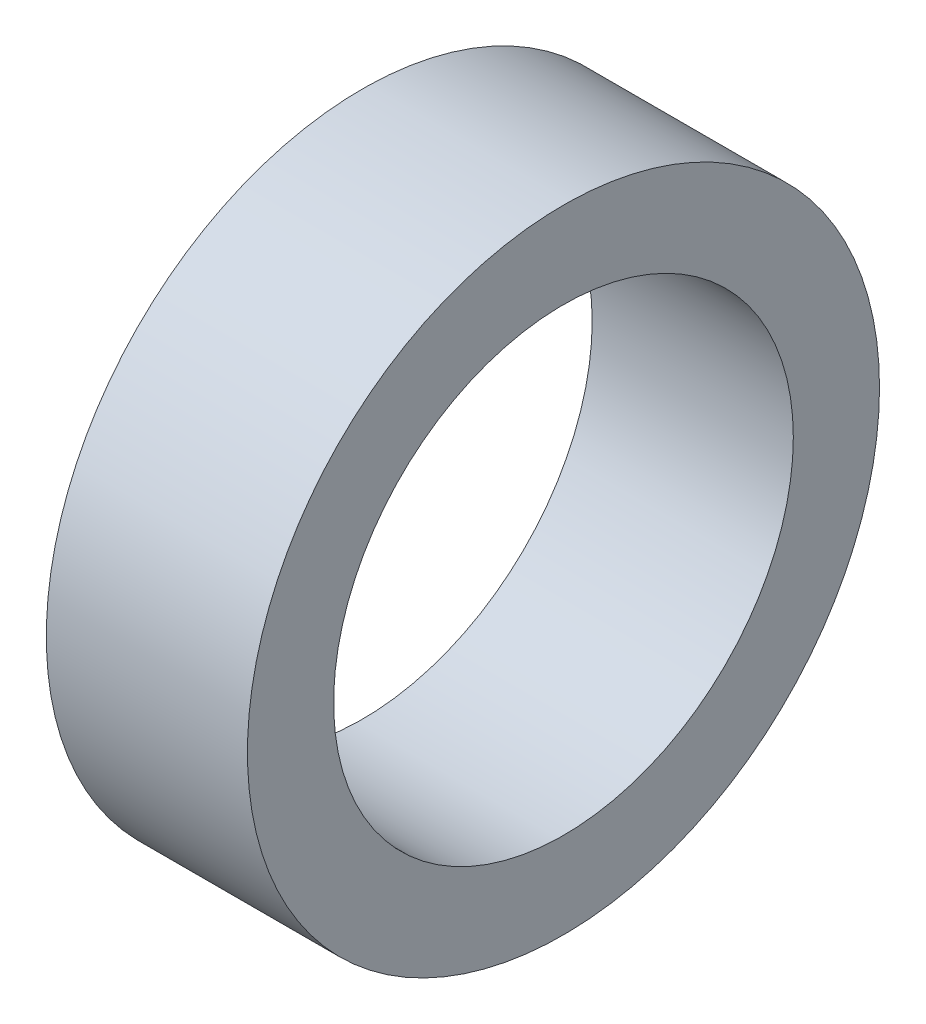
from build123d import *

# Parameters (mm, degrees)
SKETCH1_R           = 27.5
SKETCH1_R_2         = 20
BOSS_EXTRUDE1_DEPTH = 17.5


with BuildPart() as part:
    # Sketch1 → Boss-Extrude1 (new body)
    with BuildSketch(Plane.YZ):
        with Locations(Location((0, 0, 0), (0, 0, 270))):
            Circle(SKETCH1_R)
        with Locations(Location((0, 0, 0), (0, 0, 270))):
            Circle(SKETCH1_R_2, mode=Mode.SUBTRACT)
    extrude(amount=BOSS_EXTRUDE1_DEPTH)


solid = part.part
